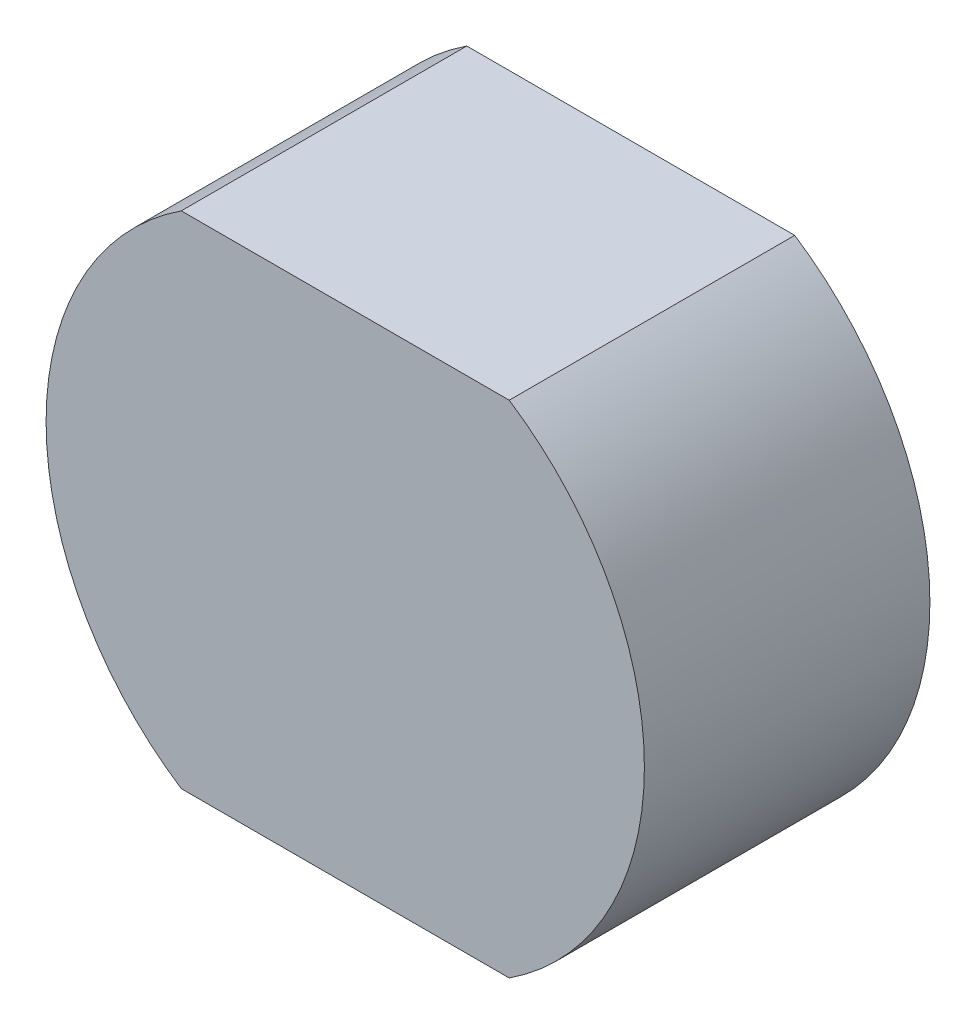
from build123d import *

# Parameters (mm, degrees)
BOSS_EXTRUDE1_DEPTH      = 1
BOSS_EXTRUDE1_DEPTH_BACK = 1


with BuildPart() as part:
    # Sketch1 → Boss-Extrude1 (new, two sides: drawn at the far end of the back side and taken through both)
    with BuildSketch(Plane.XY.offset(-BOSS_EXTRUDE1_DEPTH_BACK)):
        with BuildLine():
            Line((-1.148700783, 1.7526), (1.148700783, 1.7526))
            ThreePointArc((1.148700783, 1.7526), (2.0955, 0), (1.148700783, -1.7526))
            Line((1.148700783, -1.7526), (-1.148700783, -1.7526))
            ThreePointArc((-1.148700783, -1.7526), (-2.0955, 0), (-1.148700783, 1.7526))
        make_face()
    extrude(amount=BOSS_EXTRUDE1_DEPTH + BOSS_EXTRUDE1_DEPTH_BACK)


solid = part.part
